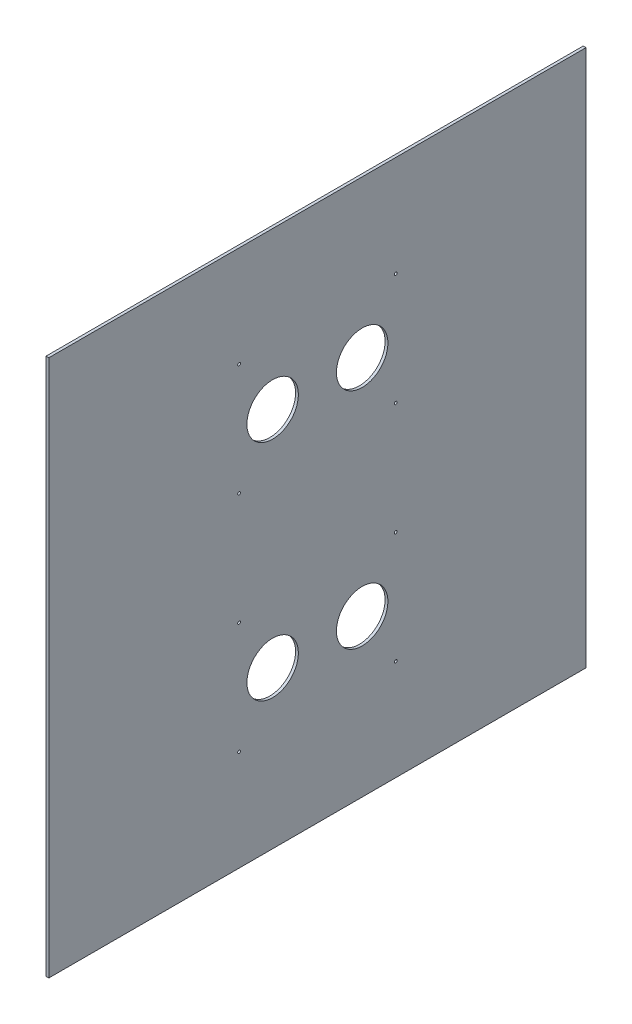
from build123d import *

# Parameters (mm, degrees)
SKETCH1_W           = 609.6
SKETCH1_H           = 609.6
BOSS_EXTRUDE1_DEPTH = 3.175
SKETCH2_R           = 29.21
CUT_EXTRUDE1_DEPTH  = 432.063986695
SKETCH3_R           = 1.5875
CUT_EXTRUDE2_DEPTH  = 432.063986695


with BuildPart() as part:
    # Sketch1 → Boss-Extrude1 (new body)
    with BuildSketch(Plane(origin=(0, 0, 0), x_dir=(0, 0, -1), z_dir=(1, 0, 0))):
        Rectangle(SKETCH1_W, SKETCH1_H)
    extrude(amount=BOSS_EXTRUDE1_DEPTH)

    # Sketch2 → Cut-Extrude1 (cut, through all)
    with BuildSketch(Plane(origin=(3.175, 0, 0), x_dir=(0, 0, -1), z_dir=(1, 0, 0))):
        with Locations((-50.8, -127)):
            Circle(SKETCH2_R)
        with Locations((50.8, -127)):
            Circle(SKETCH2_R)
    cut_extrude1 = extrude(amount=-CUT_EXTRUDE1_DEPTH, mode=Mode.SUBTRACT)

    # Sketch3 → Cut-Extrude2 (cut, through all)
    with BuildSketch(Plane(origin=(3.175, 0, 0), x_dir=(0, 0, -1), z_dir=(1, 0, 0))):
        with Locations((-88.9, -63.5)):
            Circle(SKETCH3_R)
        with Locations((88.9, -63.5)):
            Circle(SKETCH3_R)
        with Locations((-88.9, -190.5)):
            Circle(SKETCH3_R)
        with Locations((88.9, -190.5)):
            Circle(SKETCH3_R)
    cut_extrude2 = extrude(amount=-CUT_EXTRUDE2_DEPTH, mode=Mode.SUBTRACT)

    # Mirror1: Cut-Extrude1, Cut-Extrude2 across plane
    add(cut_extrude1.mirror(Plane.ZX), mode=Mode.SUBTRACT)
    add(cut_extrude2.mirror(Plane.ZX), mode=Mode.SUBTRACT)


solid = part.part
